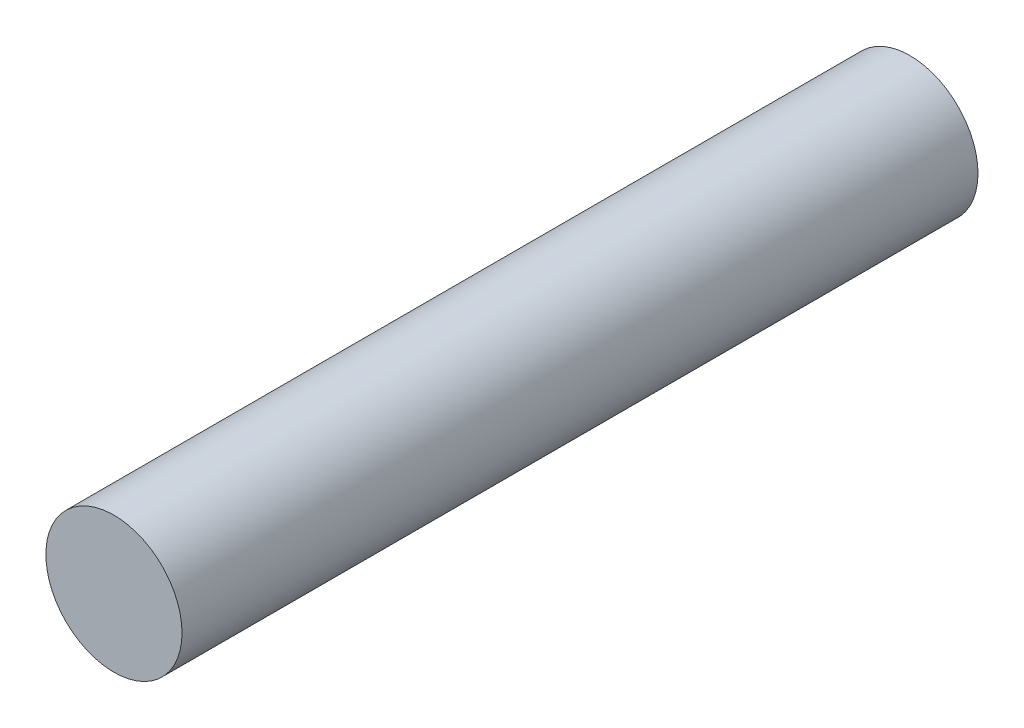
from build123d import *

# Parameters (mm, degrees)
SKETCH2_R           = 6.5
BOSS_EXTRUDE1_DEPTH = 76


with BuildPart() as part:
    # Sketch2 → Boss-Extrude1 (new body)
    with BuildSketch(Plane.XY):
        Circle(SKETCH2_R)
    extrude(amount=BOSS_EXTRUDE1_DEPTH)


solid = part.part
